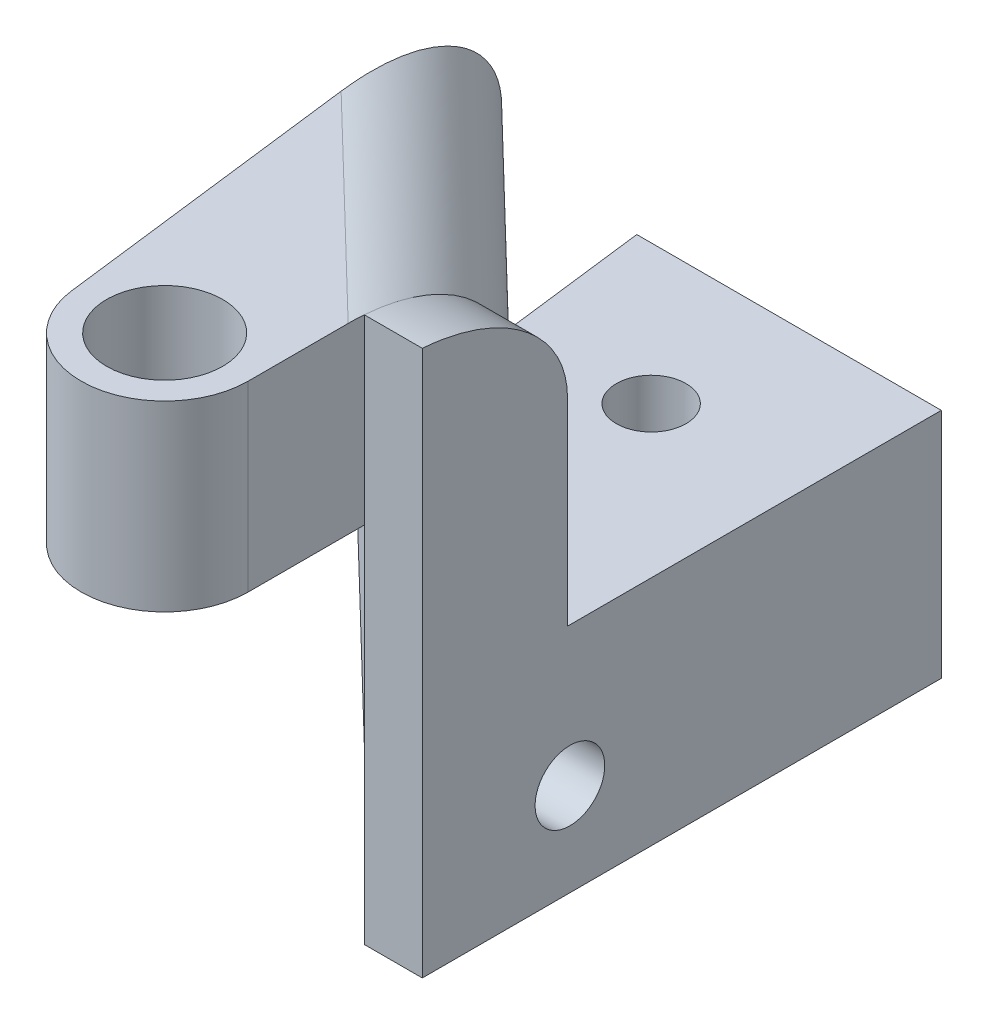
from build123d import *

# Parameters (mm, degrees)
CROQUIS1_R              = 1.5
SALIENTE_EXTRUIR1_DEPTH = 2.5
SALIENTE_EXTRUIR2_START = 8.15
CROQUIS1_3_R            = 2.5
SALIENTE_EXTRUIR2_DEPTH = 7.87
SALIENTE_EXTRUIR5_DEPTH = 16.02
REDONDEO3_R             = 5
CROQUIS8_W              = 22.36
CROQUIS8_H              = 7.5
CROQUIS8_R              = 1.5
SALIENTE_EXTRUIR6_DEPTH = 2.5


with BuildPart() as part:
    # Croquis1 → Saliente-Extruir1 (new body)
    with BuildSketch(Plane(origin=(0, 0, 0), x_dir=(1, 0, 0), z_dir=(0, 1, 0))):
        Polygon((3.6, 27.36), (-7.02, 27.36), (-5.314994069, 13.6091097), (3.6, 5), align=None)
        with Locations(Location((-0.4, 21.36, 0), (0, 0, 270))):
            Circle(CROQUIS1_R, mode=Mode.SUBTRACT)
    extrude(amount=SALIENTE_EXTRUIR1_DEPTH)



with BuildPart() as body_2:
    # Croquis1<3> → Saliente-Extruir2 (new body)
    with BuildSketch(Plane(origin=(0, 0, 0), x_dir=(1, 0, 0), z_dir=(0, 1, 0)).offset(SALIENTE_EXTRUIR2_START)):
        with BuildLine():
            Line((3.6, 5), (-5.314994069, 13.6091097))
            Line((-5.314994069, 13.6091097), (-3.572641648, -0.442980423))
            ThreePointArc((-3.572641648, -0.442980423), (0.221912221, -3.593153902), (3.6, 0))
            Line((3.6, 0), (3.6, 5))
        make_face()
        with Locations(Location((0, 0, 0), (0, 0, 270))):
            Circle(CROQUIS1_3_R, mode=Mode.SUBTRACT)
    extrude(amount=SALIENTE_EXTRUIR2_DEPTH)


with BuildPart() as part_1:
    add(part.part)

    add(body_2.part)  # Saliente-Extruir5 merges body 2
    # Croquis1<6> → Saliente-Extruir5 (add)
    with BuildSketch(Plane(origin=(0, 0, 0), x_dir=(1, 0, 0), z_dir=(0, 1, 0))):
        Polygon((3.6, 11.25573616), (-6.196167881, 20.715785518), (-5.314994069, 13.6091097), (3.6, 5), align=None)
    extrude(amount=SALIENTE_EXTRUIR5_DEPTH)

    # Redondeo3
    redondeo3_edges = [part_1.edges().sort_by_distance(p)[0] for p in [
        (-1.29808394, 16.02, -15.985760839),
    ]]
    fillet(redondeo3_edges, radius=REDONDEO3_R)

    # Croquis8 → Saliente-Extruir6 (add)
    # profile 1 of 2: a face of its own
    with BuildSketch(Plane(origin=(3.6, 0, 0), x_dir=(0, 0, -1), z_dir=(1, 0, 0))):
        with BuildLine():
            Line((5, 15.994937186), (5, 8.15))
            Line((5, 8.15), (5, 0))
            Line((5, 0), (27.36, 0))
            Line((27.36, 0), (27.36, 2.5))
            Line((27.36, 2.5), (11.25573616, 2.5))
            Line((11.25573616, 2.5), (11.25573616, 11.02))
            add(Edge.make_bspline(
                [(11.25573616, 11.02), (11.25573616, 15.542670169), (5, 15.994937186)],
                knots=[3.141592654, 3.141592654, 3.141592654, 4.603302756, 4.603302756, 4.603302756], degree=2, weights=[1, 0.727447175, 0.962144349]))
        make_face()
    # profile 2 of 2: a face of its own
    with BuildSketch(Plane(origin=(3.6, 0, 0), x_dir=(0, 0, -1), z_dir=(1, 0, 0))):
        with Locations((16.18, -3.75)):
            Rectangle(CROQUIS8_W, CROQUIS8_H)
        with Locations((11.36, -3.5)):
            Circle(CROQUIS8_R, mode=Mode.SUBTRACT)
    extrude(amount=SALIENTE_EXTRUIR6_DEPTH)


solid = part_1.part
